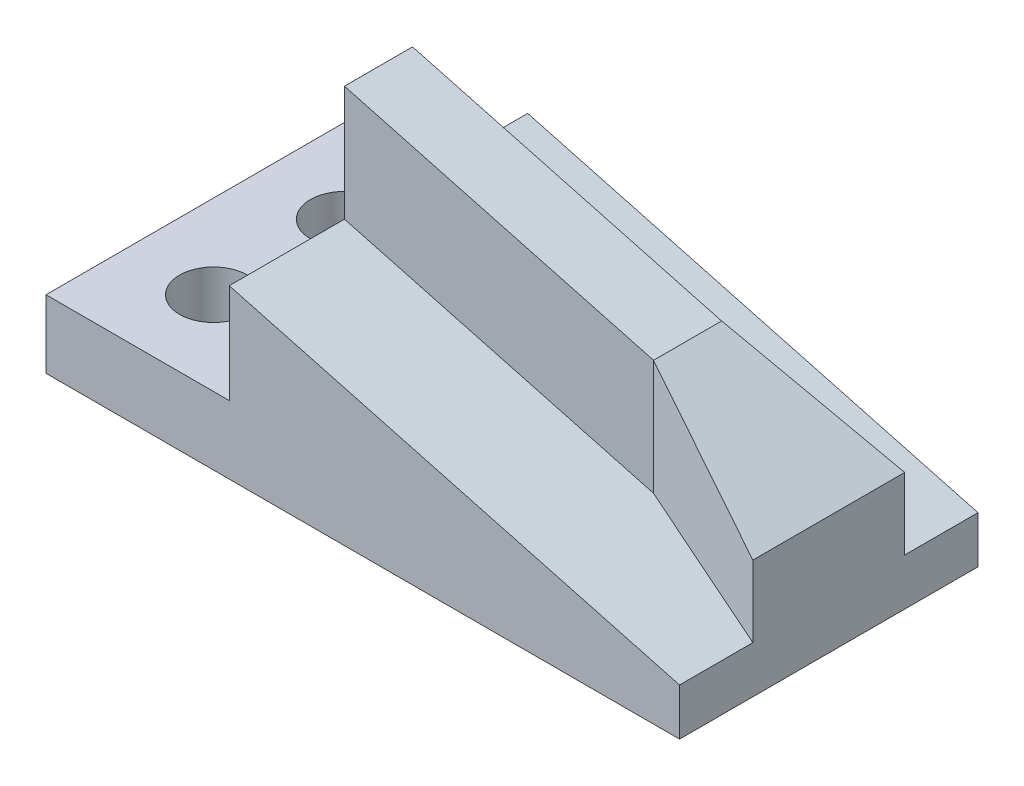
from build123d import *

# Parameters (mm, degrees)
SKETCH1_W           = 121
SKETCH1_H           = 57
BOSS_EXTRUDE1_DEPTH = 13
SKETCH3_W           = 86
SKETCH3_H           = 41
BOSS_EXTRUDE2_DEPTH = 57
CUT_EXTRUDE1_DEPTH  = 41
BOSS_EXTRUDE3_START = -57
BOSS_EXTRUDE3_DEPTH = 57
CUT_EXTRUDE3_DEPTH  = 100.122399083
CUT_EXTRUDE4_REACH  = 101.122
CUT_EXTRUDE5_REACH  = 101.122
SKETCH10_R          = 6.5
CUT_EXTRUDE6_DEPTH  = 79.444247718


with BuildPart() as part:
    # Sketch1 → Boss-Extrude1 (new body)
    with BuildSketch(Plane(origin=(0, 0, 0), x_dir=(1, 0, 0), z_dir=(0, 1, 0))):
        Rectangle(SKETCH1_W, SKETCH1_H)
    extrude(amount=BOSS_EXTRUDE1_DEPTH)

    # Sketch3 → Boss-Extrude2 (add)
    with BuildSketch(Plane.XY.offset(28.5)):
        with Locations((17.5, 33.5)):
            Rectangle(SKETCH3_W, SKETCH3_H)
    extrude(amount=-BOSS_EXTRUDE2_DEPTH)

    # Sketch5 → Cut-Extrude1 (cut)
    with BuildSketch(Plane(origin=(0, 54, 0), x_dir=(1, 0, 0), z_dir=(0, 1, 0))):
        Polygon((-25.5, -6.5), (33.5, -6.5), (60.5, -14.5), (60.5, -28.5), (-25.5, -28.5), align=None)
        Polygon((33.5, 6.5), (60.5, 14.5), (60.5, 28.5), (-25.5, 28.5), (-25.5, 6.5), align=None)
    extrude(amount=-CUT_EXTRUDE1_DEPTH, mode=Mode.SUBTRACT)

    # Sketch6 → Boss-Extrude3 (add)
    with BuildSketch(Plane.XY.offset(28.5).offset(BOSS_EXTRUDE3_START)):
        Polygon((-25.5, 32), (60.5, 8.956369451), (-25.5, 13), align=None)
    extrude(amount=BOSS_EXTRUDE3_DEPTH)

    # Sketch7 → Cut-Extrude3 (cut, through all)
    with BuildSketch(Plane.XY.offset(28.5)):
        Polygon((-25.5, 54), (33.536835762, 38.181127534), (60.5, 22.613937403), (60.5, 54), align=None)
    extrude(amount=-CUT_EXTRUDE3_DEPTH, mode=Mode.SUBTRACT)

    # Cut-Extrude4: up to this face of the body (flat: up to its plane)
    cut_extrude4_end = Plane(part.part.faces().sort_by_distance((45.301820021, 22.632080787, 9.996835562))[0])
    # Sketch8 → Cut-Extrude4 (cut, up to the picked face)
    with BuildSketch(Plane.XY.offset(28.5), mode=Mode.PRIVATE) as cut_extrude4_sk1:
        Polygon((45.408965344, 13), (60.5, 13), (60.5, 8.956369451), align=None)
    cut_extrude4_tool1 = split(extrude(cut_extrude4_sk1.sketch, amount=-CUT_EXTRUDE4_REACH, mode=Mode.PRIVATE), bisect_by=cut_extrude4_end, keep=Keep.BOTH, mode=Mode.PRIVATE)
    add(cut_extrude4_tool1.solids().sort_by(Axis((55.469655, 11.652123, 28.5), (0, 0, -1)))[0], mode=Mode.SUBTRACT)

    # Cut-Extrude5: up to this face of the body (flat: up to its plane)
    cut_extrude5_end = Plane(part.part.faces().sort_by_distance((45.301820021, 22.632080787, -9.996835562))[0])
    # Sketch9 → Cut-Extrude5 (cut, up to the picked face)
    with BuildSketch(Plane(origin=(0, 0, -28.5), x_dir=(-1, 0, 0), z_dir=(0, 0, -1)), mode=Mode.PRIVATE) as cut_extrude5_sk1:
        Polygon((-45.408965344, 13), (-60.5, 13), (-60.5, 8.956369451), align=None)
    cut_extrude5_tool1 = split(extrude(cut_extrude5_sk1.sketch, amount=-CUT_EXTRUDE5_REACH, mode=Mode.PRIVATE), bisect_by=cut_extrude5_end, keep=Keep.BOTH, mode=Mode.PRIVATE)
    add(cut_extrude5_tool1.solids().sort_by(Axis((55.469655, 11.652123, -28.5), (0, 0, 1)))[0], mode=Mode.SUBTRACT)

    # Sketch10 → Cut-Extrude6 (cut, through all)
    with BuildSketch(Plane(origin=(0, 13, 0), x_dir=(1, 0, 0), z_dir=(0, 1, 0))):
        with Locations(Location((-44.5, 12.5, 0), (0, 0, 270))):
            Circle(SKETCH10_R)
        with Locations(Location((-44.5, -12.5, 0), (0, 0, 270))):
            Circle(SKETCH10_R)
    extrude(amount=-CUT_EXTRUDE6_DEPTH, mode=Mode.SUBTRACT)


solid = part.part
